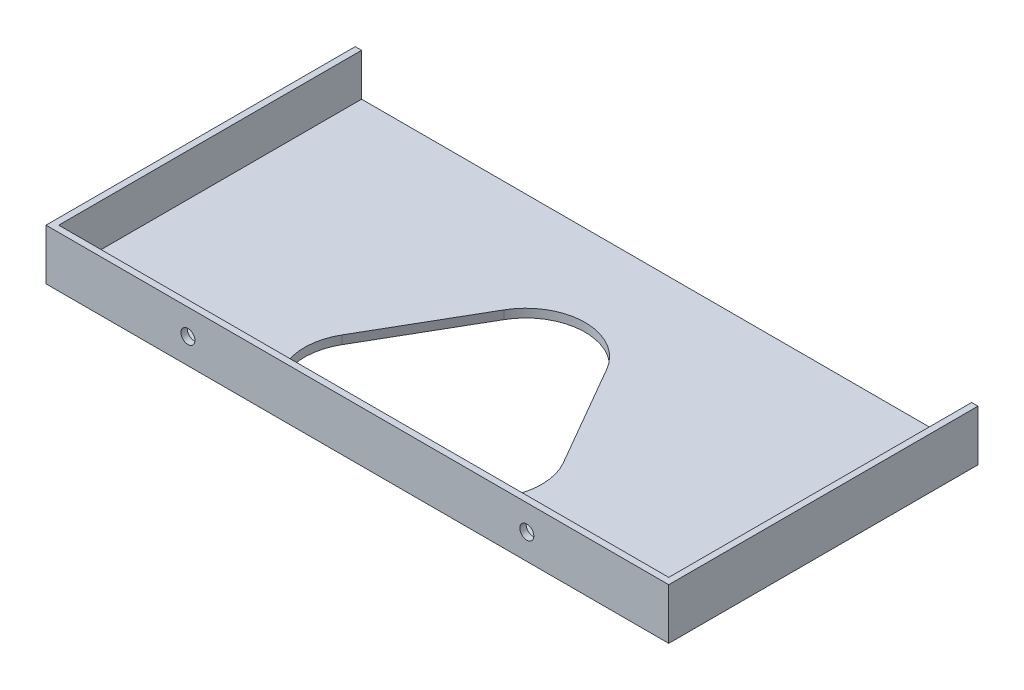
from build123d import *

# Parameters (mm, degrees)
SKETCH_1_W          = 147
SKETCH_1_H          = 76
EXTRUDE_1_DEPTH     = 12
SKETCH_2_W          = 144
SKETCH_2_H          = 73
CUT_EXTRUDE_1_DEPTH = 10
SKETCH_3_R          = 1.65
CUT_EXTRUDE_2_DEPTH = 166.918654768
CUT_EXTRUDE_3_DEPTH = 10
SKETCH_6_W          = 147
SKETCH_6_H          = 3
CUT_EXTRUDE_4_DEPTH = 166.918654768


with BuildPart() as part:
    # 草图1 → 凸台-拉伸1 (new body)
    with BuildSketch(Plane(origin=(0, 0, 0), x_dir=(1, 0, 0), z_dir=(0, 1, 0))):
        with Locations((73.5, 38)):
            Rectangle(SKETCH_1_W, SKETCH_1_H)
    extrude(amount=EXTRUDE_1_DEPTH)

    # 草图2 → 切除-拉伸1 (cut)
    with BuildSketch(Plane(origin=(0, 12, 0), x_dir=(1, 0, 0), z_dir=(0, 1, 0))):
        with Locations((73.5, 38)):
            Rectangle(SKETCH_2_W, SKETCH_2_H)
    extrude(amount=-CUT_EXTRUDE_1_DEPTH, mode=Mode.SUBTRACT)

    # 草图3 → 切除-拉伸2 (cut, through all)
    with BuildSketch(Plane(origin=(0, 0, -76), x_dir=(-1, 0, 0), z_dir=(0, 0, -1))):
        with Locations((-113.5, 6)):
            Circle(SKETCH_3_R)
        with Locations((-33.5, 6)):
            Circle(SKETCH_3_R)
    extrude(amount=-CUT_EXTRUDE_2_DEPTH, mode=Mode.SUBTRACT)

    # 草图5 → 切除-拉伸3 (cut)
    with BuildSketch(Plane.XZ):
        with BuildLine():
            Line((61.375644347, -46.748711306), (47.375644347, -22.5))
            ThreePointArc((47.375644347, -22.5), (47.375644347, -8.5), (59.5, -1.5))
            Line((59.5, -1.5), (87.5, -1.5))
            ThreePointArc((87.5, -1.5), (99.624355653, -8.5), (99.624355653, -22.5))
            Line((99.624355653, -22.5), (85.624355653, -46.748711306))
            ThreePointArc((85.624355653, -46.748711306), (73.5, -53.748711306), (61.375644347, -46.748711306))
        make_face()
    extrude(amount=-CUT_EXTRUDE_3_DEPTH, mode=Mode.SUBTRACT)

    # 草图6 → 切除-拉伸4 (cut, through all)
    with BuildSketch(Plane(origin=(0, 12, 0), x_dir=(1, 0, 0), z_dir=(0, 1, 0))):
        with Locations((73.5, 74.5)):
            Rectangle(SKETCH_6_W, SKETCH_6_H)
    extrude(amount=-CUT_EXTRUDE_4_DEPTH, mode=Mode.SUBTRACT)


solid = part.part
